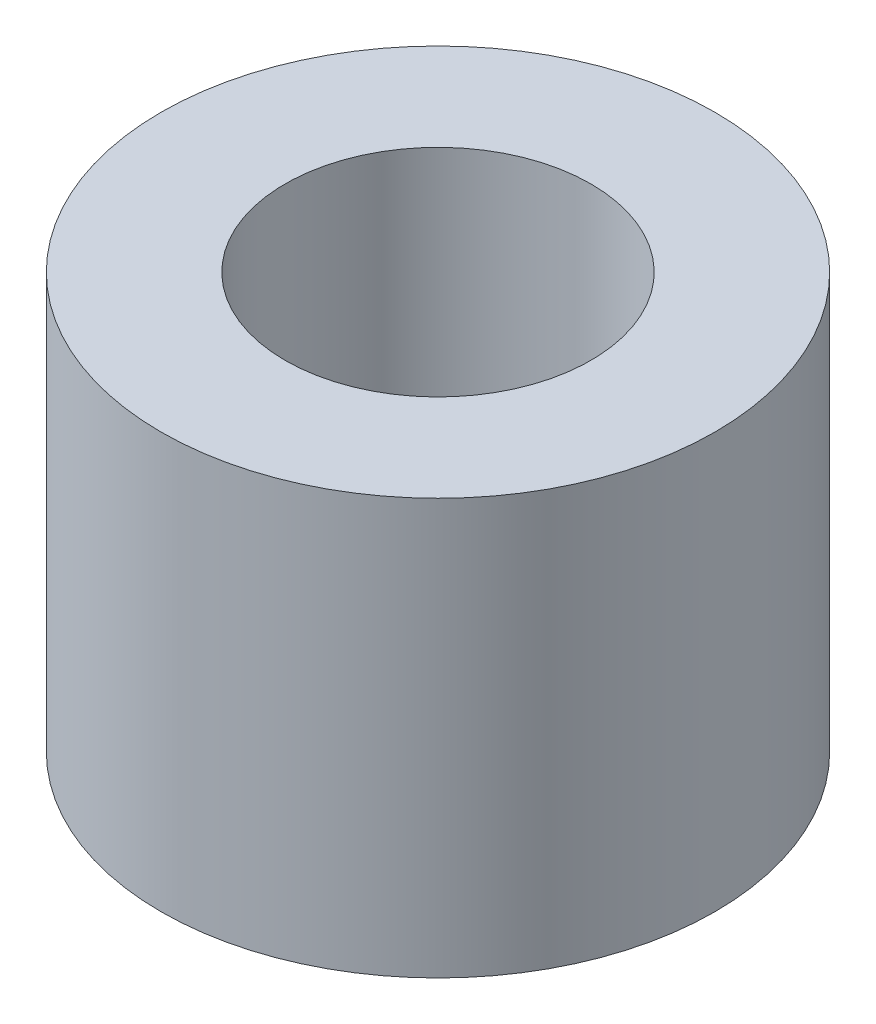
from build123d import *

# Parameters (mm, degrees)
SKETCH1_R       = 3.175
SKETCH1_R_2     = 1.7526
THICKNESS_DEPTH = 4.7625


with BuildPart() as part:
    # Sketch1 → Thickness (new body)
    with BuildSketch(Plane(origin=(0, 0, 0), x_dir=(1, 0, 0), z_dir=(0, 1, 0))):
        with Locations(Location((0, 0, 0), (0, 0, 90))):
            Circle(SKETCH1_R)
        with Locations(Location((0, 0, 0), (0, 0, 90))):
            Circle(SKETCH1_R_2, mode=Mode.SUBTRACT)
    extrude(amount=THICKNESS_DEPTH)


solid = part.part
